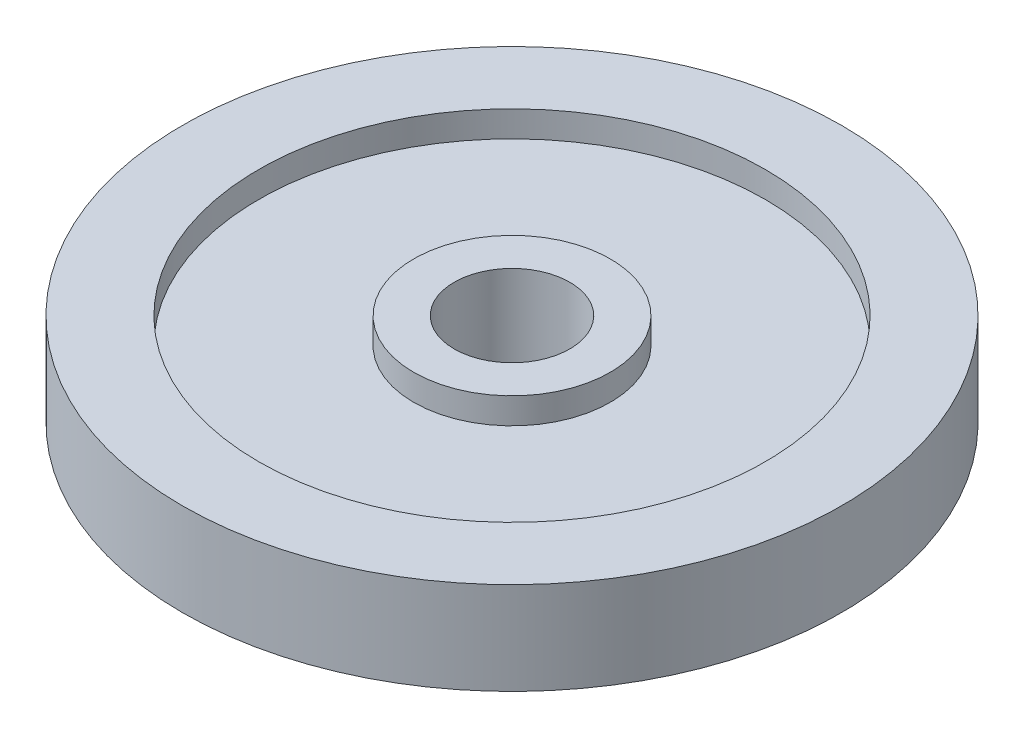
from build123d import *

# Parameters (mm, degrees)
SKETCH1_R          = 36.195
SKETCH1_R_2        = 6.35
DISK_DEPTH         = 10.16
SKETCH2_R          = 27.813
SKETCH2_R_2        = 10.795
CUT_EXTRUDE1_DEPTH = 2.8575


with BuildPart() as part:
    # Sketch1 → Disk (new body)
    with BuildSketch(Plane(origin=(0, 0, 0), x_dir=(1, 0, 0), z_dir=(0, 1, 0))):
        with Locations(Location((0, 0, 0), (0, 0, 270))):
            Circle(SKETCH1_R)
        with Locations(Location((0, 0, 0), (0, 0, 270))):
            Circle(SKETCH1_R_2, mode=Mode.SUBTRACT)
    extrude(amount=DISK_DEPTH)

    # Sketch2 → Cut-Extrude1 (cut)
    with BuildSketch(Plane(origin=(0, 10.16, 0), x_dir=(1, 0, 0), z_dir=(0, 1, 0))):
        with Locations(Location((0, 0, 0), (0, 0, 270))):
            Circle(SKETCH2_R)
        with Locations(Location((0, 0, 0), (0, 0, 270))):
            Circle(SKETCH2_R_2, mode=Mode.SUBTRACT)
    cut_extrude1 = extrude(amount=-CUT_EXTRUDE1_DEPTH, mode=Mode.SUBTRACT)

    # Mirror1: Cut-Extrude1 across plane
    add(cut_extrude1.mirror(Plane.ZX.offset(5.08)), mode=Mode.SUBTRACT)


solid = part.part
